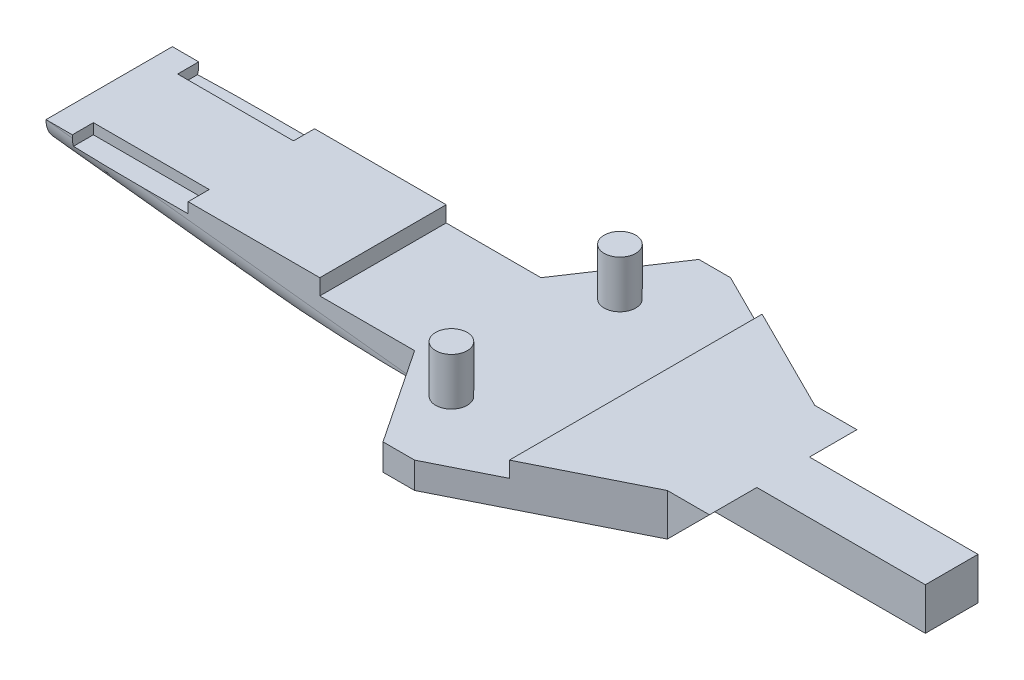
from build123d import *

# Parameters (mm, degrees)
BOSS_EXTRUDE1_DEPTH = 4
SKETCH2_R           = 1.5
BOSS_EXTRUDE2_DEPTH = 3
CUT_EXTRUDE1_DEPTH  = 13
CUT_EXTRUDE2_DEPTH  = 49
CUT_EXTRUDE3_DEPTH  = 37
SKETCH6_R           = 1.5
BOSS_EXTRUDE3_DEPTH = 5
SKETCH7_W           = 11
SKETCH7_H           = 1
CUT_EXTRUDE4_DEPTH  = 2
CUT_EXTRUDE5_START  = -12
SKETCH7_2_W         = 11
SKETCH7_2_H         = 1
CUT_EXTRUDE5_DEPTH  = 2
SKETCH8_W           = 14
SKETCH8_H           = 4
BOSS_EXTRUDE4_DEPTH = 3
SKETCH9_W           = 5
SKETCH9_H           = 4
BOSS_EXTRUDE5_DEPTH = 12
CUT_EXTRUDE6_DEPTH  = 4.5
CUT_EXTRUDE7_START  = -14
CUT_EXTRUDE7_DEPTH  = 4.5


with BuildPart() as part:
    # Sketch1 → Boss-Extrude1 (new body)
    with BuildSketch(Plane(origin=(0, 0, 0), x_dir=(1, 0, 0), z_dir=(0, 1, 0))):
        Polygon((-1, 15), (2, 15), (18, 7), (23, 7), (23, -7), (18, -7), (2, -15), (-1, -15), (-7, -6), (-42, -6), (-42, 6), (-7, 6), align=None)
    extrude(amount=BOSS_EXTRUDE1_DEPTH)

    # Sketch2 → Boss-Extrude2 (add)
    with BuildSketch(Plane(origin=(0, 4, 0), x_dir=(1, 0, 0), z_dir=(0, 1, 0))):
        with Locations(Location((-1.5, 8, 0), (0, 0, 270))):
            Circle(SKETCH2_R)
        with Locations(Location((-1.5, -8, 0), (0, 0, 90))):
            Circle(SKETCH2_R)
    extrude(amount=BOSS_EXTRUDE2_DEPTH)

    # Sketch3 → Cut-Extrude1 (cut)
    with BuildSketch(Plane.XY.offset(6)):
        Polygon((-24, 0), (-42, 2), (-42, 0), align=None)
    extrude(amount=-CUT_EXTRUDE1_DEPTH, mode=Mode.SUBTRACT)

    # Sketch4 → Cut-Extrude2 (cut, along a direction that is not the sketch's normal)
    with BuildSketch(Plane.ZY.offset(42)):
        with BuildLine():
            ThreePointArc((-5, 2), (-5.736067977, 2.881966011), (-6, 4))
            Line((-6, 4), (-6, 2))
            Line((-6, 2), (-5, 2))
        make_face()
        with BuildLine():
            Line((1.25, 2.910275264), (-1.25, 2.910275264))
            ThreePointArc((-1.25, 2.910275264), (-1.570550528, 2.410275264), (-2, 2))
            Line((-2, 2), (2, 2))
            ThreePointArc((2, 2), (1.570550528, 2.410275264), (1.25, 2.910275264))
        make_face()
        with BuildLine():
            Line((5, 2), (6, 2))
            Line((6, 2), (6, 4))
            ThreePointArc((6, 4), (5.736067977, 2.881966011), (5, 2))
        make_face()
    extrude(amount=-CUT_EXTRUDE2_DEPTH, dir=(-0.9938837346736189, 0.11043152607484653, 0), mode=Mode.SUBTRACT)

    # Sketch5 → Cut-Extrude3 (cut)
    with BuildSketch(Plane.XY.offset(15)):
        Polygon((-7, 4), (8, 4), (8, 2.5), (-7, 2.5), (-16, 2.5), (-16, 4), align=None)
    extrude(amount=-CUT_EXTRUDE3_DEPTH, mode=Mode.SUBTRACT)


with BuildPart() as cut_extrude3_piece_1:
    # of the separate pieces the step leaves, piece 1, a body of its own (cut_extrude3_pieces)
    add(part.part.solids().sort_by_distance((-1, 0, -15))[0])



with BuildPart() as cut_extrude3_piece_2:
    # of the separate pieces the step leaves, piece 2, a body of its own (cut_extrude3_pieces)
    add(part.part.solids().sort_by_distance((-1.5, 4, -6.5))[0])


with BuildPart() as cut_extrude3_piece_3:
    # of the separate pieces the step leaves, piece 3, a body of its own (cut_extrude3_pieces)
    add(part.part.solids().sort_by_distance((-1.5, 4, 6.5))[0])


with BuildPart() as cut_extrude3_piece_1_1:
    add(cut_extrude3_piece_1.part)

    add(cut_extrude3_piece_2.part)  # Boss-Extrude3 merges Cut-Extrude3 piece 2

    add(cut_extrude3_piece_3.part)  # Boss-Extrude3 merges Cut-Extrude3 piece 3
    # Sketch6 → Boss-Extrude3 (add)
    with BuildSketch(Plane(origin=(0, 7, 0), x_dir=(1, 0, 0), z_dir=(0, 1, 0))):
        with Locations(Location((-1.5, -8, 0), (0, 0, 270))):
            Circle(SKETCH6_R)
        with Locations(Location((-1.5, 8, 0), (0, 0, 270))):
            Circle(SKETCH6_R)
    extrude(amount=-BOSS_EXTRUDE3_DEPTH)

    # Sketch7 → Cut-Extrude4 (cut)
    with BuildSketch(Plane.XY.offset(6)):
        with Locations((-34, 3.5)):
            Rectangle(SKETCH7_W, SKETCH7_H)
    extrude(amount=-CUT_EXTRUDE4_DEPTH, mode=Mode.SUBTRACT)

    # Sketch7<2> → Cut-Extrude5 (cut)
    with BuildSketch(Plane.XY.offset(6).offset(CUT_EXTRUDE5_START)):
        with Locations((-34, 3.5)):
            Rectangle(SKETCH7_2_W, SKETCH7_2_H)
    extrude(amount=CUT_EXTRUDE5_DEPTH, mode=Mode.SUBTRACT)

    # Sketch8 → Boss-Extrude4 (add)
    with BuildSketch(Plane(origin=(23, 0, 0), x_dir=(0, 0, -1), z_dir=(1, 0, 0))):
        with Locations((0, 2)):
            Rectangle(SKETCH8_W, SKETCH8_H)
    extrude(amount=BOSS_EXTRUDE4_DEPTH)

    # Sketch9 → Boss-Extrude5 (add)
    with BuildSketch(Plane(origin=(26, 0, 0), x_dir=(0, 0, -1), z_dir=(1, 0, 0))):
        with Locations((0, 2)):
            Rectangle(SKETCH9_W, SKETCH9_H)
    extrude(amount=BOSS_EXTRUDE5_DEPTH)

    # Sketch10 → Cut-Extrude6 (cut)
    with BuildSketch(Plane.XY.offset(7)):
        Polygon((18, 0), (22, 4), (26, 4), (26, 0), align=None)
    extrude(amount=-CUT_EXTRUDE6_DEPTH, mode=Mode.SUBTRACT)

    # Sketch10<3> → Cut-Extrude7 (cut)
    with BuildSketch(Plane.XY.offset(7).offset(CUT_EXTRUDE7_START)):
        Polygon((18, 0), (22, 4), (26, 4), (26, 0), align=None)
    extrude(amount=CUT_EXTRUDE7_DEPTH, mode=Mode.SUBTRACT)


solid = cut_extrude3_piece_1_1.part
